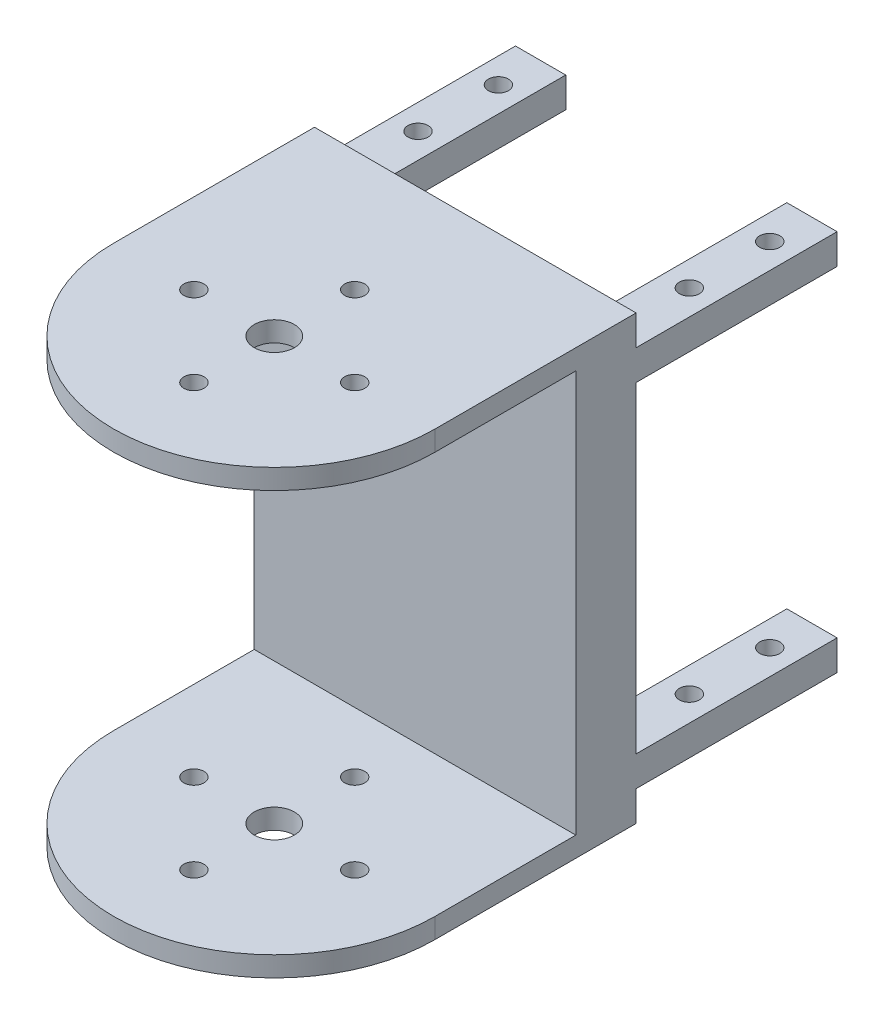
from build123d import *

# Parameters (mm, degrees)
SKETCH1_R           = 1
SKETCH1_R_2         = 2
BOSS_EXTRUDE1_DEPTH = 44
SKETCH2_W           = 30
SKETCH2_H           = 40
CUT_EXTRUDE1_DEPTH  = 58.965506985
SKETCH3_W           = 5
SKETCH3_H           = 3
BOSS_EXTRUDE2_DEPTH = 20
SKETCH4_R           = 1
CUT_EXTRUDE2_DEPTH  = 62.579217273


with BuildPart() as part:
    # Sketch1 → Boss-Extrude1 (new body)
    with BuildSketch(Plane(origin=(0, 0, 0), x_dir=(1, 0, 0), z_dir=(0, 1, 0))):
        with BuildLine():
            Line((-16, 0), (-16, 20))
            Line((-16, 20), (16, 20))
            Line((16, 20), (16, 0))
            ThreePointArc((16, 0), (0, -16), (-16, 0))
        make_face()
        with Locations(Location((0, 8, 0), (0, 0, 270))):
            Circle(SKETCH1_R, mode=Mode.SUBTRACT)
        with Locations(Location((8, 0, 0), (0, 0, 270))):
            Circle(SKETCH1_R, mode=Mode.SUBTRACT)
        with Locations(Location((0, -8, 0), (0, 0, 270))):
            Circle(SKETCH1_R, mode=Mode.SUBTRACT)
        with Locations(Location((-8, 0, 0), (0, 0, 270))):
            Circle(SKETCH1_R, mode=Mode.SUBTRACT)
        with Locations(Location((0, 0, 0), (0, 0, 270))):
            Circle(SKETCH1_R_2, mode=Mode.SUBTRACT)
    extrude(amount=BOSS_EXTRUDE1_DEPTH)

    # Sketch2 → Cut-Extrude1 (cut, through all)
    with BuildSketch(Plane(origin=(16, 0, 0), x_dir=(0, 0, -1), z_dir=(1, 0, 0))):
        with Locations((-1, 22)):
            Rectangle(SKETCH2_W, SKETCH2_H)
    extrude(amount=-CUT_EXTRUDE1_DEPTH, mode=Mode.SUBTRACT)

    # Sketch3 → Boss-Extrude2 (add)
    with BuildSketch(Plane(origin=(0, 0, -20), x_dir=(-1, 0, 0), z_dir=(0, 0, -1))):
        with Locations((-13.5, 39.5)):
            Rectangle(SKETCH3_W, SKETCH3_H)
        with Locations((13.5, 39.5)):
            Rectangle(SKETCH3_W, SKETCH3_H)
        with Locations((-13.5, 4.5)):
            Rectangle(SKETCH3_W, SKETCH3_H)
        with Locations((13.5, 4.5)):
            Rectangle(SKETCH3_W, SKETCH3_H)
    extrude(amount=BOSS_EXTRUDE2_DEPTH)

    # Sketch4 → Cut-Extrude2 (cut, through all)
    with BuildSketch(Plane.XZ):
        with Locations((-13.5, -27.8)):
            Circle(SKETCH4_R)
        with Locations((-13.5, -35.8)):
            Circle(SKETCH4_R)
        with Locations(Location((13.5, -27.8, 0), (0, 0, 270))):
            Circle(SKETCH4_R)
        with Locations(Location((13.5, -35.8, 0), (0, 0, 270))):
            Circle(SKETCH4_R)
    extrude(amount=-CUT_EXTRUDE2_DEPTH, mode=Mode.SUBTRACT)


solid = part.part
